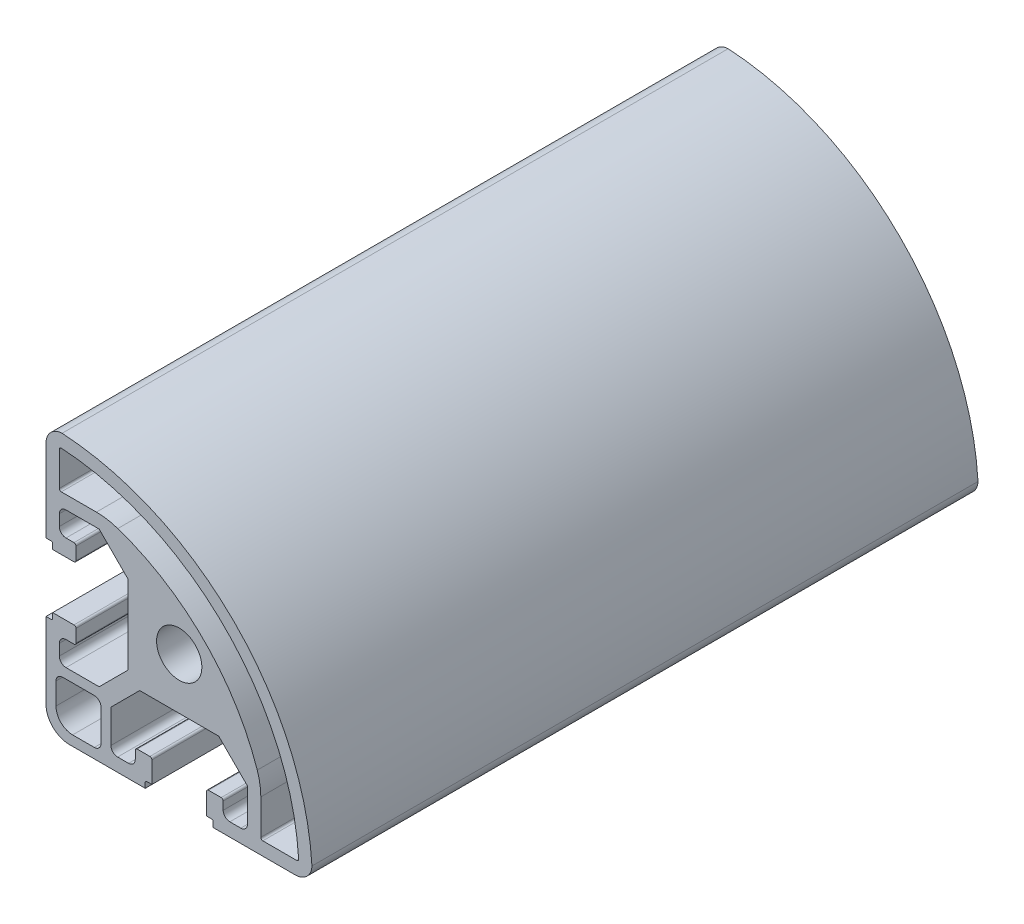
from build123d import *

# Parameters (mm, degrees)
SKETCH_1_R      = 3.4
EXTRUDE_1_DEPTH = 100


with BuildPart() as part:
    # 草图1 → 凸台-拉伸1 (new body)
    with BuildSketch(Plane.XY):
        with BuildLine():
            Line((-23.338979522, 16.722515545), (-23.338979522, 4.394054978))
            Line((-23.338979522, 4.394054978), (-22.538979522, 4.394054978))
            ThreePointArc((-22.538979522, 4.394054978), (-22.397558165, 4.335476334), (-22.338979522, 4.194054978))
            Line((-22.338979522, 4.194054978), (-22.338979522, 3.394054978))
            Line((-22.338979522, 3.394054978), (-19.138979522, 3.394054978))
            ThreePointArc((-19.138979522, 3.394054978), (-18.926847487, 3.481922943), (-18.838979522, 3.694054978))
            Line((-18.838979522, 3.694054978), (-18.838979522, 5.594054978))
            ThreePointArc((-18.838979522, 5.594054978), (-18.926847487, 5.806187012), (-19.138979522, 5.894054978))
            Line((-19.138979522, 5.894054978), (-20.338979522, 5.894054978))
            ThreePointArc((-20.338979522, 5.894054978), (-21.046086303, 6.186948197), (-21.338979522, 6.894054978))
            Line((-21.338979522, 6.894054978), (-21.338979522, 8.544054978))
            ThreePointArc((-21.338979522, 8.544054978), (-21.046086303, 9.251161759), (-20.338979522, 9.544054978))
            Line((-20.338979522, 9.544054978), (-15.356746475, 9.544054978))
            Line((-15.356746475, 9.544054978), (-11.038979522, 5.226288025))
            Line((-11.038979522, 5.226288025), (-11.038979522, -6.638178069))
            Line((-11.038979522, -6.638178069), (-15.356746475, -10.955945022))
            Line((-15.356746475, -10.955945022), (-20.338979522, -10.955945022))
            ThreePointArc((-20.338979522, -10.955945022), (-21.046086303, -10.663051803), (-21.338979522, -9.955945022))
            Line((-21.338979522, -9.955945022), (-21.338979522, -8.305945022))
            ThreePointArc((-21.338979522, -8.305945022), (-21.046086303, -7.598838241), (-20.338979522, -7.305945022))
            Line((-20.338979522, -7.305945022), (-19.138979522, -7.305945022))
            ThreePointArc((-19.138979522, -7.305945022), (-18.926847487, -7.218077057), (-18.838979522, -7.005945022))
            Line((-18.838979522, -7.005945022), (-18.838979522, -5.105945022))
            ThreePointArc((-18.838979522, -5.105945022), (-18.926847487, -4.893812988), (-19.138979522, -4.805945022))
            Line((-19.138979522, -4.805945022), (-22.338979522, -4.805945022))
            Line((-22.338979522, -4.805945022), (-22.338979522, -5.605945022))
            ThreePointArc((-22.338979522, -5.605945022), (-22.397558165, -5.747366379), (-22.538979522, -5.805945022))
            Line((-22.538979522, -5.805945022), (-23.338979522, -5.805945022))
            Line((-23.338979522, -5.805945022), (-23.338979522, -17.205945022))
            ThreePointArc((-23.338979522, -17.205945022), (-22.313853256, -19.680818756), (-19.838979522, -20.705945022))
            Line((-19.838979522, -20.705945022), (-8.438979522, -20.705945022))
            Line((-8.438979522, -20.705945022), (-8.438979522, -19.905945022))
            ThreePointArc((-8.438979522, -19.905945022), (-8.380400878, -19.764523666), (-8.238979522, -19.705945022))
            Line((-8.238979522, -19.705945022), (-7.438979522, -19.705945022))
            Line((-7.438979522, -19.705945022), (-7.438979522, -16.505945022))
            ThreePointArc((-7.438979522, -16.505945022), (-7.526847487, -16.293812988), (-7.738979522, -16.205945022))
            Line((-7.738979522, -16.205945022), (-9.638979522, -16.205945022))
            ThreePointArc((-9.638979522, -16.205945022), (-9.851111556, -16.293812988), (-9.938979522, -16.505945022))
            Line((-9.938979522, -16.505945022), (-9.938979522, -17.705945022))
            ThreePointArc((-9.938979522, -17.705945022), (-10.231872741, -18.413051803), (-10.938979522, -18.705945022))
            Line((-10.938979522, -18.705945022), (-12.588979522, -18.705945022))
            ThreePointArc((-12.588979522, -18.705945022), (-13.296086303, -18.413051803), (-13.588979522, -17.705945022))
            Line((-13.588979522, -17.705945022), (-13.588979522, -12.723711975))
            Line((-13.588979522, -12.723711975), (-9.271212569, -8.405945022))
            Line((-9.271212569, -8.405945022), (2.593253525, -8.405945022))
            Line((2.593253525, -8.405945022), (6.911020478, -12.723711975))
            Line((6.911020478, -12.723711975), (6.911020478, -17.705945022))
            ThreePointArc((6.911020478, -17.705945022), (6.618127259, -18.413051803), (5.911020478, -18.705945022))
            Line((5.911020478, -18.705945022), (4.261020478, -18.705945022))
            ThreePointArc((4.261020478, -18.705945022), (3.553913697, -18.413051803), (3.261020478, -17.705945022))
            Line((3.261020478, -17.705945022), (3.261020478, -16.505945022))
            ThreePointArc((3.261020478, -16.505945022), (3.173152513, -16.293812988), (2.961020478, -16.205945022))
            Line((2.961020478, -16.205945022), (1.061020478, -16.205945022))
            ThreePointArc((1.061020478, -16.205945022), (0.848888444, -16.293812988), (0.761020478, -16.505945022))
            Line((0.761020478, -16.505945022), (0.761020478, -19.705945022))
            Line((0.761020478, -19.705945022), (1.561020478, -19.705945022))
            ThreePointArc((1.561020478, -19.705945022), (1.702441835, -19.764523666), (1.761020478, -19.905945022))
            Line((1.761020478, -19.905945022), (1.761020478, -20.705945022))
            Line((1.761020478, -20.705945022), (14.089481045, -20.705945022))
            ThreePointArc((14.089481045, -20.705945022), (15.826995028, -20.003455845), (16.588041197, -18.290781149))
            ThreePointArc((16.588041197, -18.290781149), (4.945291726, 7.578326225), (-20.923815648, 19.221075696))
            ThreePointArc((-20.923815648, 19.221075696), (-22.636490345, 18.460029528), (-23.338979522, 16.722515545))
        make_face()
        with Locations((-3.338979522, -0.705945022)):
            Circle(SKETCH_1_R, mode=Mode.SUBTRACT)
        with BuildLine():
            Line((-15.088979522, -13.455945022), (-15.088979522, -18.209945022))
            ThreePointArc((-15.088979522, -18.209945022), (-15.381872741, -18.917051803), (-16.088979522, -19.209945022))
            Line((-16.088979522, -19.209945022), (-19.342979522, -19.209945022))
            ThreePointArc((-19.342979522, -19.209945022), (-21.110746475, -18.477711975), (-21.842979522, -16.709945022))
            Line((-21.842979522, -16.709945022), (-21.842979522, -13.455945022))
            ThreePointArc((-21.842979522, -13.455945022), (-21.550086303, -12.748838241), (-20.842979522, -12.455945022))
            Line((-20.842979522, -12.455945022), (-16.088979522, -12.455945022))
            ThreePointArc((-16.088979522, -12.455945022), (-15.381872741, -12.748838241), (-15.088979522, -13.455945022))
        make_face(mode=Mode.SUBTRACT)
        with BuildLine():
            Line((-15.776737791, 11.544054978), (-21.038979522, 11.544054978))
            ThreePointArc((-21.038979522, 11.544054978), (-21.251111556, 11.631922943), (-21.338979522, 11.844054978))
            Line((-21.338979522, 11.844054978), (-21.338979522, 16.923830422))
            ThreePointArc((-21.338979522, 16.923830422), (-21.244538861, 17.142337534), (-21.020677134, 17.223271606))
            ThreePointArc((-21.020677134, 17.223271606), (3.531078163, 6.164112663), (14.590237107, -18.387642635))
            ThreePointArc((14.590237107, -18.387642635), (14.509303035, -18.611504361), (14.290795923, -18.705945022))
            Line((14.290795923, -18.705945022), (9.211020478, -18.705945022))
            ThreePointArc((9.211020478, -18.705945022), (8.998888444, -18.618077057), (8.911020478, -18.405945022))
            Line((8.911020478, -18.405945022), (8.911020478, -13.143703291))
            ThreePointArc((8.911020478, -13.143703291), (8.777145631, -11.512883109), (8.379105585, -9.925728086))
            ThreePointArc((8.379105585, -9.925728086), (0.349097648, 2.982132147), (-12.558762586, 11.012140084))
            ThreePointArc((-12.558762586, 11.012140084), (-14.145917608, 11.410180131), (-15.776737791, 11.544054978))
        make_face(mode=Mode.SUBTRACT)
    extrude(amount=EXTRUDE_1_DEPTH)


solid = part.part
